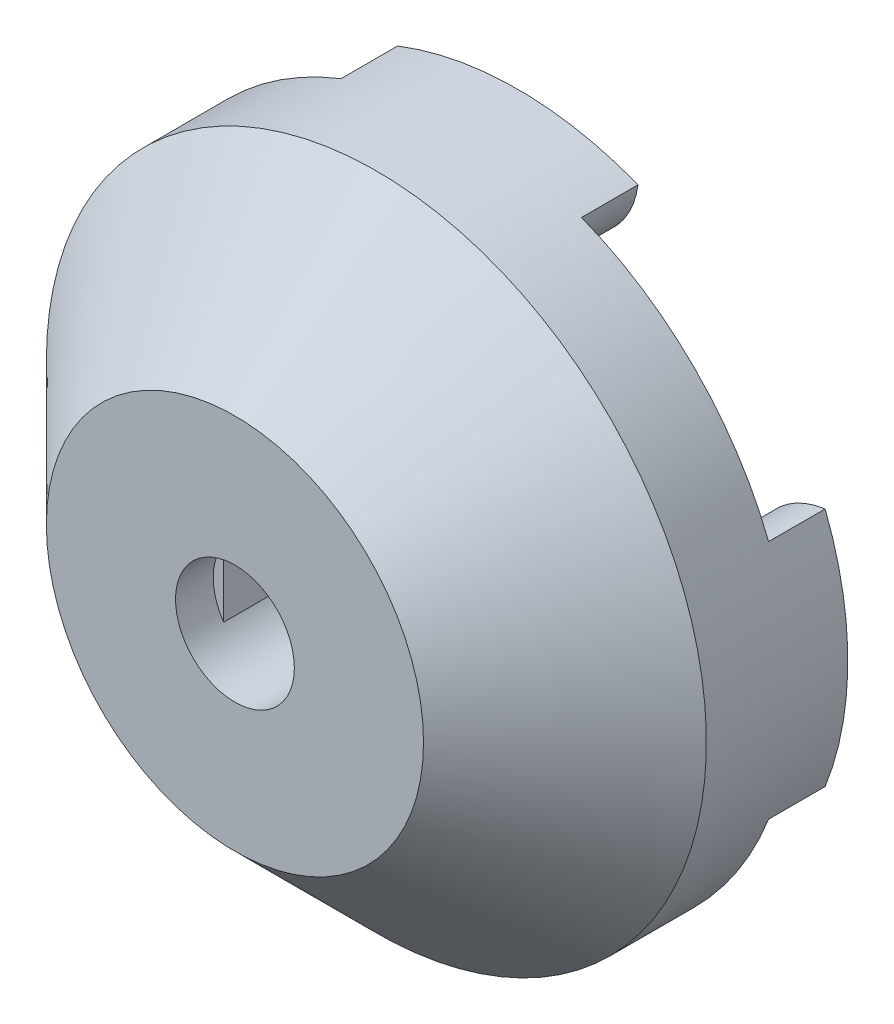
from build123d import *
from build123d.topology import SkipClean

# Parameters (mm, degrees)
BASEMODELSKETCH_R                  = 17.5
BASEMODEL_DEPTH                    = 12
KEYTOOTH_DEPTH                     = 3
PATTERNKEY_COUNT                   = 4
CENTERHOLESUPPORTEXTRUSIONSKETCH_R = 6
CENTERHOLESUPPORTEXTRUSION_DEPTH   = 3
INNERHOLEWITHKEY_DEPTH             = 29.939592257
HOLEFORSPRINGAXLESKETCH_R          = 3.5
HOLEFORSPRINGAXLE_DEPTH            = 3.5
ENCODERKEYEND_R                    = 3.15
ENDOERKEYEND_DEPTH                 = 2
CHAMFER1_SIZE                      = 7.5


with BuildPart() as part:
    # BaseModelSketch → BaseModel (new body)
    with BuildSketch(Plane.XY):
        Circle(BASEMODELSKETCH_R)
    extrude(amount=-BASEMODEL_DEPTH)

    # KeyToothSketch → KeyTooth (add)
    with BuildSketch(Plane(origin=(0, 0, -12), x_dir=(-1, 0, 0), z_dir=(0, 0, -1))):
        with BuildLine():
            ThreePointArc((6.375, -16.297526653), (4.683181341, -13.344473155), (1.407662434, -12.420486563))
            ThreePointArc((1.407662434, -12.420486563), (0, -12.5), (-1.407662434, -12.420486563))
            ThreePointArc((-1.407662434, -12.420486563), (-4.683181341, -13.344473155), (-6.375, -16.297526653))
            ThreePointArc((-6.375, -16.297526653), (0, -17.5), (6.375, -16.297526653))
        make_face()
    keytooth = extrude(amount=KEYTOOTH_DEPTH)

    # PatternKey: KeyTooth ×4 about axis
    with SkipClean():  # the faces are left unmerged after this step: merging them gives an invalid solid
        patternkey_axis = Axis((0, 0, 0), (0, 0, 1))
        for i in range(1, PATTERNKEY_COUNT):
            add(keytooth.rotate(patternkey_axis, i * 360 / PATTERNKEY_COUNT))

    # CenterHoleSupportExtrusionSketch → CenterHoleSupportExtrusion (add)
    with SkipClean():  # the faces are left unmerged after this step: merging them gives an invalid solid
        with BuildSketch(Plane(origin=(0, 0, -12), x_dir=(-1, 0, 0), z_dir=(0, 0, -1))):
            with Locations(Location((0, 0, 0), (0, 0, 180))):
                Circle(CENTERHOLESUPPORTEXTRUSIONSKETCH_R)
        extrude(amount=CENTERHOLESUPPORTEXTRUSION_DEPTH)

    # InnerHoleWithKeySketch → InnerHoleWithKey (cut, through all)
    with SkipClean():  # the faces are left unmerged after this step: merging them gives an invalid solid
        with BuildSketch(Plane.XY):
            with BuildLine():
                Line((-2.6, 1.778341924), (-2.6, -1.778341924))
                ThreePointArc((-2.6, -1.778341924), (3.15, 0), (-2.6, 1.778341924))
            make_face()
        extrude(amount=-INNERHOLEWITHKEY_DEPTH, mode=Mode.SUBTRACT)

    # HoleforSpringAxleSketch → HoleforSpringAxle (cut)
    with SkipClean():  # the faces are left unmerged after this step: merging them gives an invalid solid
        with BuildSketch(Plane(origin=(0, 0, -15), x_dir=(-1, 0, 0), z_dir=(0, 0, -1))):
            Circle(HOLEFORSPRINGAXLESKETCH_R)
        extrude(amount=-HOLEFORSPRINGAXLE_DEPTH, mode=Mode.SUBTRACT)

    # EncoderKeyEnd → EndoerKeyEnd (cut)
    with SkipClean():  # the faces are left unmerged after this step: merging them gives an invalid solid
        with BuildSketch(Plane.XY):
            Circle(ENCODERKEYEND_R)
        extrude(amount=-ENDOERKEYEND_DEPTH, mode=Mode.SUBTRACT)

    # Chamfer1
    chamfer1_edges = [part.edges().sort_by_distance(p)[0] for p in [
        (-17.5, 0, 0),
    ]]
    chamfer(chamfer1_edges, length=CHAMFER1_SIZE)


solid = part.part
